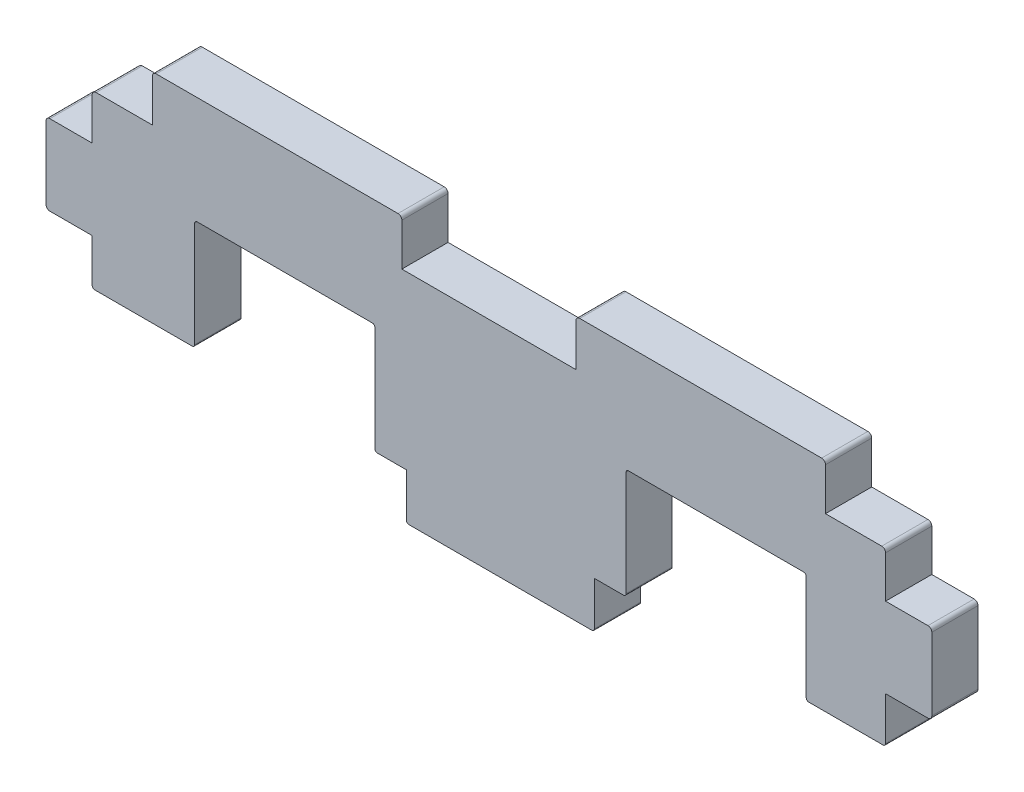
from build123d import *

# Parameters (mm, degrees)
BOSS_EXTRUDE1_DEPTH = 3


with BuildPart() as part:
    # Sketch2 → Boss-Extrude1 (new body)
    with BuildSketch(Plane.XY):
        with BuildLine():
            Line((53.652188988, 7.790592853), (53.652188988, 4.988083366))
            ThreePointArc((53.652188988, 4.988083366), (53.60349827, 4.870533572), (53.485948476, 4.821842853))
            Line((53.485948476, 4.821842853), (48.668429501, 4.821842853))
            ThreePointArc((48.668429501, 4.821842853), (48.550879707, 4.870533572), (48.502188988, 4.988083366))
            Line((48.502188988, 4.988083366), (48.502188988, 11.80560234))
            ThreePointArc((48.502188988, 11.80560234), (48.45349827, 11.923152134), (48.335948476, 11.971842853))
            Line((48.335948476, 11.971842853), (36.968429501, 11.971842853))
            ThreePointArc((36.968429501, 11.971842853), (36.850879707, 11.923152134), (36.802188988, 11.80560234))
            Line((36.802188988, 11.80560234), (36.802188988, 4.988083366))
            ThreePointArc((36.802188988, 4.988083366), (36.75349827, 4.870533572), (36.635948476, 4.821842853))
            Line((36.635948476, 4.821842853), (34.752188988, 4.821842853))
            Line((34.752188988, 4.821842853), (34.752188988, 1.988083366))
            ThreePointArc((34.752188988, 1.988083366), (34.70349827, 1.870533572), (34.585948476, 1.821842853))
            Line((34.585948476, 1.821842853), (22.718429501, 1.821842853))
            ThreePointArc((22.718429501, 1.821842853), (22.600879707, 1.870533572), (22.552188988, 1.988083366))
            Line((22.552188988, 1.988083366), (22.552188988, 4.821842853))
            Line((22.552188988, 4.821842853), (20.668429501, 4.821842853))
            ThreePointArc((20.668429501, 4.821842853), (20.550879707, 4.870533572), (20.502188988, 4.988083366))
            Line((20.502188988, 4.988083366), (20.502188988, 11.80560234))
            ThreePointArc((20.502188988, 11.80560234), (20.45349827, 11.923152134), (20.335948476, 11.971842853))
            Line((20.335948476, 11.971842853), (8.968429501, 11.971842853))
            ThreePointArc((8.968429501, 11.971842853), (8.850879707, 11.923152134), (8.802188988, 11.80560234))
            Line((8.802188988, 11.80560234), (8.802188988, 4.988083366))
            ThreePointArc((8.802188988, 4.988083366), (8.75349827, 4.870533572), (8.635948476, 4.821842853))
            Line((8.635948476, 4.821842853), (2.318429501, 4.821842853))
            ThreePointArc((2.318429501, 4.821842853), (2.200879707, 4.870533572), (2.152188988, 4.988083366))
            Line((2.152188988, 4.988083366), (2.152188988, 7.790592853))
            Line((2.152188988, 7.790592853), (-0.597811012, 7.790592853))
            ThreePointArc((-0.597811012, 7.790592853), (-0.774587707, 7.863816157), (-0.847811012, 8.040592853))
            Line((-0.847811012, 8.040592853), (-0.847811012, 12.740592853))
            ThreePointArc((-0.847811012, 12.740592853), (-0.774587707, 12.917369548), (-0.597811012, 12.990592853))
            Line((-0.597811012, 12.990592853), (2.152188988, 12.990592853))
            Line((2.152188988, 12.990592853), (2.152188988, 15.709342853))
            ThreePointArc((2.152188988, 15.709342853), (2.225412293, 15.886119548), (2.402188988, 15.959342853))
            Line((2.402188988, 15.959342853), (6.052188988, 15.959342853))
            Line((6.052188988, 15.959342853), (6.052188988, 18.709342853))
            ThreePointArc((6.052188988, 18.709342853), (6.125412293, 18.886119548), (6.302188988, 18.959342853))
            Line((6.302188988, 18.959342853), (22.002188988, 18.959342853))
            ThreePointArc((22.002188988, 18.959342853), (22.178965684, 18.886119548), (22.252188988, 18.709342853))
            Line((22.252188988, 18.709342853), (22.252188988, 15.959342853))
            Line((22.252188988, 15.959342853), (33.552188988, 15.959342853))
            Line((33.552188988, 15.959342853), (33.552188988, 18.709342853))
            ThreePointArc((33.552188988, 18.709342853), (33.625412293, 18.886119548), (33.802188988, 18.959342853))
            Line((33.802188988, 18.959342853), (49.502188988, 18.959342853))
            ThreePointArc((49.502188988, 18.959342853), (49.678965684, 18.886119548), (49.752188988, 18.709342853))
            Line((49.752188988, 18.709342853), (49.752188988, 15.959342853))
            Line((49.752188988, 15.959342853), (53.402188988, 15.959342853))
            ThreePointArc((53.402188988, 15.959342853), (53.578965684, 15.886119548), (53.652188988, 15.709342853))
            Line((53.652188988, 15.709342853), (53.652188988, 12.990592853))
            Line((53.652188988, 12.990592853), (56.402188988, 12.990592853))
            ThreePointArc((56.402188988, 12.990592853), (56.578965684, 12.917369548), (56.652188988, 12.740592853))
            Line((56.652188988, 12.740592853), (56.652188988, 8.040592853))
            ThreePointArc((56.652188988, 8.040592853), (56.578965684, 7.863816157), (56.402188988, 7.790592853))
            Line((56.402188988, 7.790592853), (53.652188988, 7.790592853))
        make_face()
    extrude(amount=BOSS_EXTRUDE1_DEPTH)


solid = part.part
